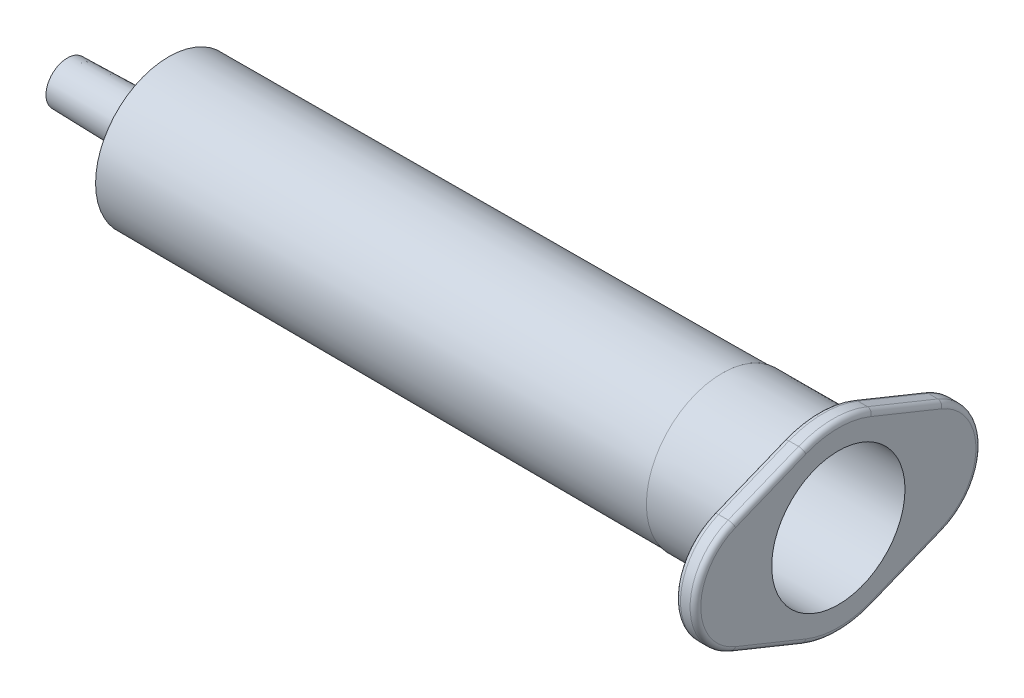
from build123d import *

# Parameters (mm, degrees)
BOSS_EXTRUDE3_DEPTH = 1.9
FILLET4_R           = 8.6
FILLET5_R           = 0.25
FILLET6_R           = 0.5
FILLET7_R           = 1


with BuildPart() as part:
    # Sketch6 → Boss-Extrude3 (new body)
    with BuildSketch(Plane(origin=(72.3, 0, 0), x_dir=(0, 0, -1), z_dir=(1, 0, 0))):
        with BuildLine():
            Line((-9.834595004, -5.292759782), (0, -9.279892888))
            Line((0, -9.279892888), (9.834595004, -5.292759782))
            ThreePointArc((9.834595004, -5.292759782), (13.4, 0), (9.834595004, 5.292759782))
            Line((9.834595004, 5.292759782), (0, 9.279892888))
            Line((0, 9.279892888), (-9.834595004, 5.292759782))
            ThreePointArc((-9.834595004, 5.292759782), (-13.4, 0), (-9.834595004, -5.292759782))
        make_face()
    extrude(amount=-BOSS_EXTRUDE3_DEPTH)

    # Sketch11 → Revolve1 (revolve)
    with BuildSketch(Plane(origin=(0, 0, 0), x_dir=(-1, 0, 0), z_dir=(0, 0, -1)), mode=Mode.PRIVATE) as revolve1_sk:
        Polygon((-70.4, 7.131416054), (-70.4, 0), (0, 0), (0, 2), (-8.5, 2.2), (-9.5, 6.85), (-61.4, 7.031165912), (-61.4, 7.1), align=None)
    revolve(revolve1_sk.sketch.rotate(Axis((70.4, 0, 0), (-1, 0, 0)), 90), axis=Axis((70.4, 0, 0), (-1, 0, 0)))

    # Sketch12 → Hole1 (revolve, cut)
    with BuildSketch(Plane(origin=(72.3, 0, 0), x_dir=(0, 0, -1), z_dir=(0, 1, 0))):
        Polygon((0, 0), (0, 72.3), (1, 72.3), (1, 63.239774349), (6.25, 62.110742091), (6.25, 0), align=None)
    revolve(axis=Axis((78.430023899, 0, 0), (-1, 0, 0)), mode=Mode.SUBTRACT)

    # Fillet4
    fillet4_edges = [part.edges().sort_by_distance(p)[0] for p in [
        (71.35, 9.279892888, 0),
        (71.35, -9.279892888, 0),
    ]]
    fillet(fillet4_edges, radius=FILLET4_R)

    # Fillet5
    fillet5_edges = [part.edges().sort_by_distance(p)[0] for p in [
        (9.060225651, 0, 1),
    ]]
    fillet(fillet5_edges, radius=FILLET5_R)

    # Fillet6
    fillet6_edges = [part.edges().sort_by_distance(p)[0] for p in [
        (70.4, 0, -13.4),
        (70.4, 6.631339679, -6.532876496),
        (70.4, 0, 7.131416054),
        (72.3, -6.631339679, -6.532876496),
        (72.3, 6.631339679, 6.532876496),
        (72.3, 8.6, 0),
        (72.3, -8.6, 0),
        (70.4, -6.631339679, -6.532876496),
        (70.4, 6.631339679, 6.532876496),
        (70.4, 8.6, 0),
        (70.4, -8.6, 0),
        (70.4, 0, 13.4),
        (72.3, 6.631339679, -6.532876496),
        (72.3, 0, -13.4),
        (70.4, -6.631339679, 6.532876496),
        (72.3, -6.631339679, 6.532876496),
        (72.3, 0, 13.4),
    ]]
    fillet(fillet6_edges, radius=FILLET6_R)

    # Fillet7
    fillet7_edges = [part.edges().sort_by_distance(p)[0] for p in [
        (8.5, 0, 2.2),
    ]]
    fillet(fillet7_edges, radius=FILLET7_R)


solid = part.part
